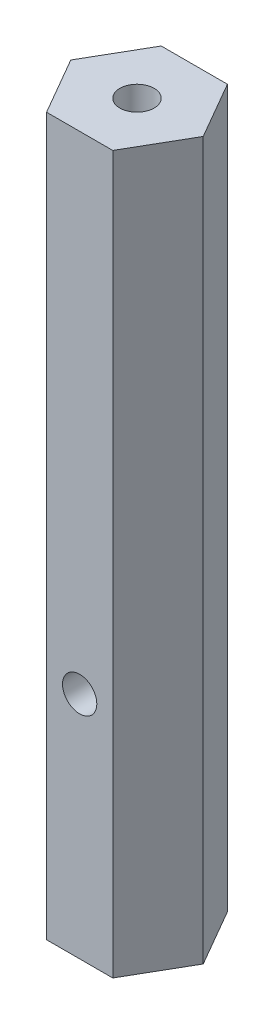
from build123d import *

# Parameters (mm, degrees)
BOSS_EXTRUDE1_DEPTH            = 79.375
TAP_DRILL_FOR_10_24_TAP1_D     = 3.7973
TAP_DRILL_FOR_10_24_TAP1_DEPTH = 25.4
TAP_DRILL_FOR_10_24_TAP1_TIP   = 1.140824014
TAP_DRILL_FOR_10_24_TAP2_D     = 3.7973
TAP_DRILL_FOR_10_24_TAP2_DEPTH = 25.4
TAP_DRILL_FOR_10_24_TAP2_TIP   = 1.140824014


with BuildPart() as part:
    # Sketch1 → Boss-Extrude1 (new body)
    with BuildSketch(Plane(origin=(0, 0, 0), x_dir=(1, 0, 0), z_dir=(0, 1, 0))):
        Polygon((7.332348419, 0), (3.666174209, 6.35), (-3.666174209, 6.35), (-7.332348419, 0), (-3.666174209, -6.35), (3.666174209, -6.35), align=None)
    extrude(amount=BOSS_EXTRUDE1_DEPTH)

    # Tap Drill for #10-24 Tap1
    with Locations(Plane(origin=(0, 79.375, 0), x_dir=(1, 0, 0), z_dir=(0, 1, 0))):
        with Locations((0, 0)):
            Hole(TAP_DRILL_FOR_10_24_TAP1_D / 2, depth=TAP_DRILL_FOR_10_24_TAP1_DEPTH)
            with Locations((0, 0, -(TAP_DRILL_FOR_10_24_TAP1_DEPTH + TAP_DRILL_FOR_10_24_TAP1_TIP / 2))):  # 118° drill point
                Cone(0, TAP_DRILL_FOR_10_24_TAP1_D / 2, TAP_DRILL_FOR_10_24_TAP1_TIP, mode=Mode.SUBTRACT)

    # Tap Drill for #10-24 Tap2
    with Locations(Plane.XY.offset(6.35)):
        with Locations((0, 25.4)):
            Hole(TAP_DRILL_FOR_10_24_TAP2_D / 2, depth=TAP_DRILL_FOR_10_24_TAP2_DEPTH)
            with Locations((0, 0, -(TAP_DRILL_FOR_10_24_TAP2_DEPTH + TAP_DRILL_FOR_10_24_TAP2_TIP / 2))):  # 118° drill point
                Cone(0, TAP_DRILL_FOR_10_24_TAP2_D / 2, TAP_DRILL_FOR_10_24_TAP2_TIP, mode=Mode.SUBTRACT)


solid = part.part
